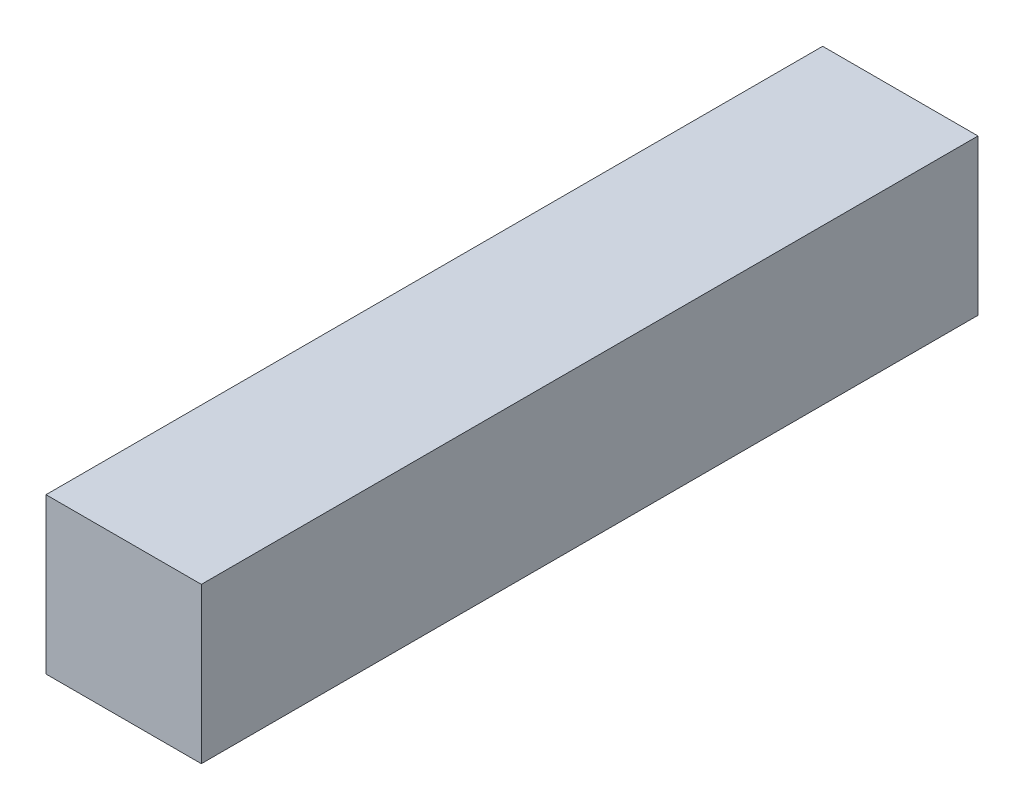
from build123d import *

# Parameters (mm, degrees)
SKETCH1_W           = 25.4
SKETCH1_H           = 25.4
BOSS_EXTRUDE1_DEPTH = 127


with BuildPart() as part:
    # Sketch1 → Boss-Extrude1 (new body)
    with BuildSketch(Plane.XY):
        Rectangle(SKETCH1_W, SKETCH1_H)
    extrude(amount=BOSS_EXTRUDE1_DEPTH)


solid = part.part
